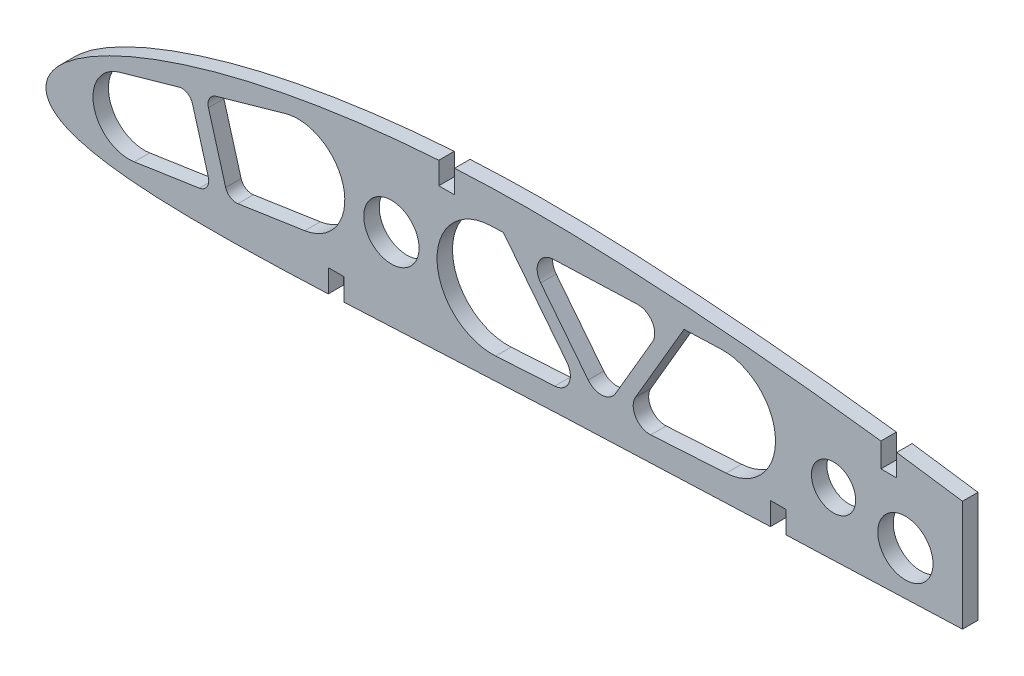
from build123d import *

# Parameters (mm, degrees)
SKETCH_1_R      = 5
SKETCH_1_R_2    = 4
EXTRUDE_1_DEPTH = 2.8


with BuildPart() as part:
    # Эскиз1 → Бобышка-Вытянуть1 (new body)
    with BuildSketch(Plane.XY):
        with BuildLine():
            Line((51.075, -6.797857762), (51.075, -2.671024813))
            Line((51.075, -2.671024813), (53.925, -2.671024813))
            Line((53.925, -2.671024813), (53.925, -6.671024813))
            add(Edge.make_bspline(
                [(53.925, -6.671024813), (55.351490294, -6.605959917), (59.05614038, -6.431258156), (65.052094605, -6.132852265), (71.910772709, -5.784005177), (78.771375576, -5.439680454), (85.610498609, -5.110951253), (92.432107589, -4.804953326), (99.25503119, -4.531981655), (106.097378404, -4.278274671), (112.96921168, -4.003089926), (119.864404254, -3.723176184), (125.90387692, -3.475714107), (129.641442278, -3.32330159), (131.075, -3.26507525)],
                knots=[0.225936021, 0.225936021, 0.225936021, 0.225936021, 0.242837762, 0.269833583, 0.296993022, 0.324123272, 0.351139107, 0.378035509, 0.404946016, 0.431960837, 0.459078395, 0.4863474, 0.51364083, 0.530622671, 0.530622671, 0.530622671, 0.530622671], degree=3))
            Line((131.075, -3.26507525), (131.075, 0.850340271))
            Line((131.075, 0.850340271), (133.925, 0.850340271))
            Line((133.925, 0.850340271), (133.925, -3.149659729))
            add(Edge.make_bspline(
                [(133.925, -3.149659729), (136.145172751, -3.06004469), (140.661874906, -2.879263539), (147.472013762, -2.613922958), (154.352602411, -2.355626415), (160.474257398, -2.136272457), (164.302612812, -2.005285527), (165.840234812, -1.953741117)],
                knots=[0.541876261, 0.541876261, 0.541876261, 0.541876261, 0.568176028, 0.595379569, 0.622543445, 0.64967326, 0.667883054, 0.667883054, 0.667883054, 0.667883054], degree=3))
            Line((165.840234812, -1.953741117), (165.840234812, 18.100452406))
            add(Edge.make_bspline(
                [(165.840234812, 18.100452406), (163.683203223, 18.425232173), (159.71367048, 19.003973482), (155.73921581, 19.54780728), (153.925, 19.788481571)],
                knots=[0.333153584, 0.333153584, 0.333153584, 0.333153584, 0.358484538, 0.379736754, 0.379736754, 0.379736754, 0.379736754], degree=3))
            Line((153.925, 19.788481571), (153.925, 15.788481571))
            Line((153.925, 15.788481571), (151.075, 15.788481571))
            Line((151.075, 15.788481571), (151.075, 20.160319166))
            add(Edge.make_bspline(
                [(151.075, 20.160319166), (149.474284365, 20.365643283), (145.693646108, 20.836528447), (139.731359791, 21.525676112), (133.19183673, 22.212004247), (126.658683026, 22.825721427), (120.136770918, 23.363973265), (113.628567141, 23.824677323), (107.152732038, 24.200242593), (100.741095693, 24.498399509), (94.411752715, 24.686649768), (88.155917993, 24.74009565), (81.949043055, 24.658849143), (77.209841741, 24.491488886), (74.539946654, 24.3566888), (73.925, 24.323459936)],
                knots=[0.390862166, 0.390862166, 0.390862166, 0.390862166, 0.409602822, 0.435103874, 0.460559416, 0.485959195, 0.51130307, 0.536551515, 0.561723366, 0.586628867, 0.611085431, 0.6352512, 0.659272176, 0.683163753, 0.690315121, 0.690315121, 0.690315121, 0.690315121], degree=3))
            Line((73.925, 24.323459936), (73.925, 20.153723887))
            Line((73.925, 20.153723887), (71.075, 20.153723887))
            Line((71.075, 20.153723887), (71.075, 24.153723887))
            add(Edge.make_bspline(
                [(71.075, 24.153723887), (70.597576883, 24.122634423), (68.091396965, 23.952373351), (63.575410501, 23.578006361), (57.55518955, 22.924946658), (51.605762688, 22.119065522), (45.744400311, 21.156564432), (39.995857594, 20.035371389), (34.397919842, 18.756316234), (29.010382103, 17.327615608), (23.925798408, 15.771864921), (19.270678839, 14.134269434), (15.179098391, 12.483335438), (11.74047579, 10.895610995), (8.959371868, 9.429577365), (6.76089118, 8.108603199), (5.033709747, 6.924638055), (3.671694933, 5.854229664), (2.592101123, 4.871305369), (1.738175668, 3.952595743), (1.069870829, 3.080946373), (0.57164541, 2.241622102), (0.215773898, 1.430785397), (0.102255581, 0.883241694), (0.047974999, 0.621425)],
                knots=[0.701366418, 0.701366418, 0.701366418, 0.701366418, 0.706922144, 0.73053591, 0.7539832, 0.77723469, 0.800246382, 0.822950709, 0.845237155, 0.866915896, 0.887662335, 0.906968281, 0.924203157, 0.938878975, 0.950931611, 0.960693484, 0.968646729, 0.975232933, 0.980794744, 0.985583761, 0.989781539, 0.993521313, 0.996902113, 1, 1, 1, 1], degree=3))
            add(Edge.make_bspline(
                [(0.047974999, 0.621425), (0.02271382, 0.373490086), (-0.02782079, -0.122499975), (0.077991212, -0.88443459), (0.34969565, -1.63883807), (0.814331135, -2.365068924), (1.46348078, -3.039275245), (2.290973016, -3.66099947), (3.30592875, -4.235779621), (4.535255619, -4.773674144), (6.029745688, -5.282192165), (7.868981215, -5.765316676), (10.168831391, -6.221716593), (13.075438188, -6.639618731), (16.728115362, -6.992956738), (21.189952095, -7.247345145), (26.399984415, -7.376638849), (32.197398563, -7.376256913), (38.397806758, -7.26143658), (44.732922785, -7.060594684), (48.984926453, -6.888384617), (51.075, -6.797857762)],
                knots=[0, 0, 0, 0, 0.002941446, 0.005884319, 0.00901613, 0.012364547, 0.016007934, 0.020036845, 0.024573728, 0.029783835, 0.03589701, 0.04324044, 0.052275965, 0.063634589, 0.077983176, 0.095698161, 0.116520086, 0.13966073, 0.16431217, 0.18991889, 0.214680528, 0.214680528, 0.214680528, 0.214680528], degree=3))
        make_face()
        with Locations((62.5, 8.59375181)):
            Circle(SKETCH_1_R, mode=Mode.SUBTRACT)
        with Locations((142.5, 8.59375181)):
            Circle(SKETCH_1_R_2, mode=Mode.SUBTRACT)
        with Locations((155.5, 5.59375181)):
            Circle(SKETCH_1_R, mode=Mode.SUBTRACT)
        with BuildLine():
            Line((43.240598635, 17.569188334), (30.769830614, 14.020476962))
            ThreePointArc((30.769830614, 14.020476962), (29.569945088, 13.069992625), (29.393591817, 11.549451512))
            Line((29.393591817, 11.549451512), (32.509646584, 0.599111496))
            ThreePointArc((32.509646584, 0.599111496), (33.350387753, -0.534966909), (34.730673801, -0.831260624))
            Line((34.730673801, -0.831260624), (46.83094942, 0.988248665))
            ThreePointArc((46.83094942, 0.988248665), (53.874493573, 11.192609045), (43.240598635, 17.569188334))
        make_face(mode=Mode.SUBTRACT)
        with BuildLine():
            Line((91.760538944, 18.995521102), (107.042168691, 19.544535755))
            ThreePointArc((107.042168691, 19.544535755), (109.724415488, 18.086521736), (109.740513943, 15.033655279))
            Line((109.740513943, 15.033655279), (103.052906026, 3.581390706))
            ThreePointArc((103.052906026, 3.581390706), (100.670558856, 2.101444773), (98.106171984, 3.237111085))
            Line((98.106171984, 3.237111085), (89.512150154, 14.140361006))
            ThreePointArc((89.512150154, 14.140361006), (89.14598265, 17.258116644), (91.760538944, 18.995521102))
        make_face(mode=Mode.SUBTRACT)
        with BuildLine():
            Line((81.355051643, -1.388349261), (92.062288682, -0.74685976))
            ThreePointArc((92.062288682, -0.74685976), (94.620029356, 1.019769542), (94.238973726, 4.104864849))
            Line((94.238973726, 4.104864849), (82.75700632, 18.672056169))
            Line((82.75700632, 18.672056169), (80.397973485, 18.587304502))
            ThreePointArc((80.397973485, 18.587304502), (70.768464506, 8.115178476), (81.355051643, -1.388349261))
        make_face(mode=Mode.SUBTRACT)
        with BuildLine():
            Line((106.660222673, 4.801131795), (115.446016039, 19.846456126))
            Line((115.446016039, 19.846456126), (122.158918806, 20.087626868))
            ThreePointArc((122.158918806, 20.087626868), (131.989114723, 11.048396476), (123.068143057, 1.110755792))
            Line((123.068143057, 1.110755792), (109.430271671, 0.293686806))
            ThreePointArc((109.430271671, 0.293686806), (106.694931094, 1.71757295), (106.660222673, 4.801131795))
        make_face(mode=Mode.SUBTRACT)
        with BuildLine():
            Line((26.508143632, 10.728361523), (29.377650553, 0.644432062))
            ThreePointArc((29.377650553, 0.644432062), (29.13549016, -0.985852219), (27.751413523, -1.880726711))
            Line((27.751413523, -1.880726711), (15.966534054, -3.652810119))
            ThreePointArc((15.966534054, -3.652810119), (8.647226299, 1.39933087), (13.220971689, 9.02673198))
            Line((13.220971689, 9.02673198), (24.037118182, 12.104600319))
            ThreePointArc((24.037118182, 12.104600319), (25.557659294, 11.928247048), (26.508143632, 10.728361523))
        make_face(mode=Mode.SUBTRACT)
    extrude(amount=EXTRUDE_1_DEPTH)


solid = part.part
